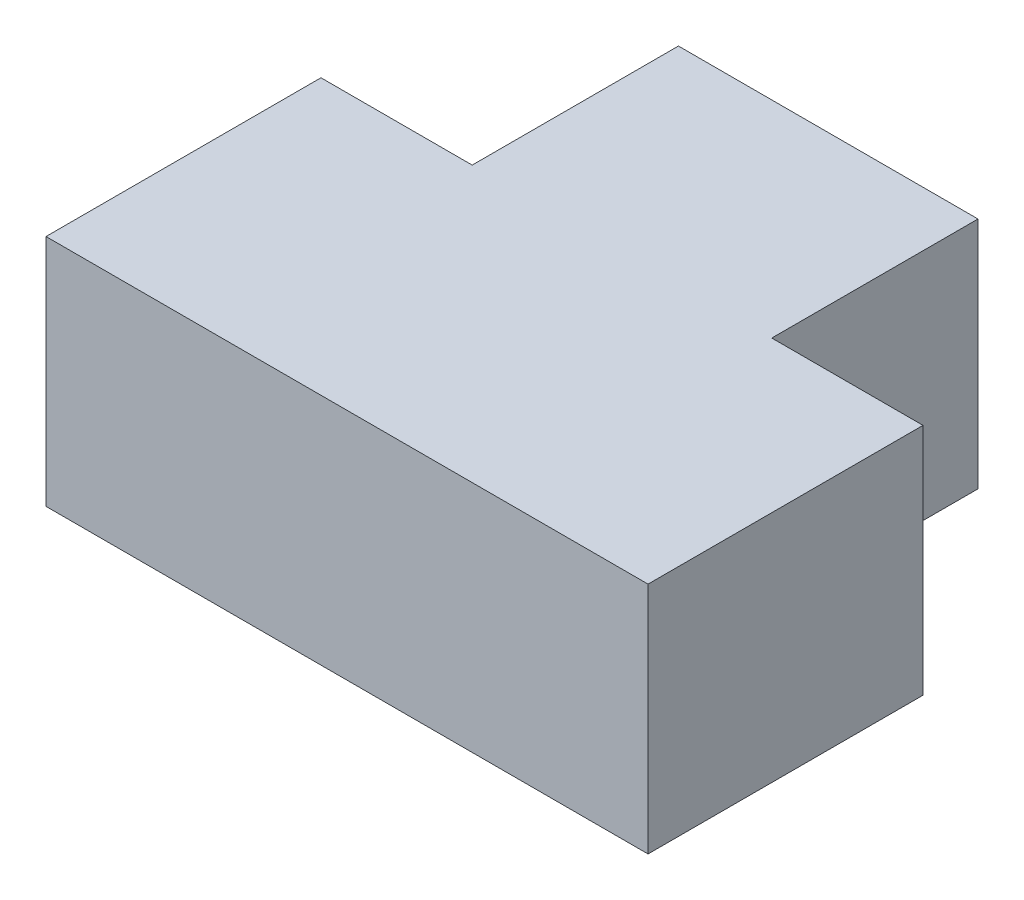
from build123d import *

# Parameters (mm, degrees)
EXTRUDE_1_DEPTH     = 3.4
SKETCH_2_W          = 0.4
SKETCH_2_H          = 3
CUT_EXTRUDE_1_DEPTH = 7.83637537


with BuildPart() as part:
    # Эскиз1 → Бобышка-Вытянуть1 (new body)
    with BuildSketch(Plane(origin=(0, 0, 0), x_dir=(1, 0, 0), z_dir=(0, 1, 0))):
        Polygon((2.37904421, -4), (-2.37904421, -4), (-4.37904421, -4), (-4.37904421, 0), (-2.37904421, 0), (-2.37904421, 3), (2.37904421, 3), (2.37904421, 0), (4.37904421, 0), (4.37904421, -4), align=None)
    extrude(amount=EXTRUDE_1_DEPTH)

    # Эскиз2 → Вырез-Вытянуть1 (cut, through all)
    with BuildSketch(Plane(origin=(0, 0, 0), x_dir=(1, 0, 0), z_dir=(0, 1, 0))):
        with Locations((2.37904421, 1.5)):
            Rectangle(SKETCH_2_W, SKETCH_2_H)
        with Locations((-2.37904421, 1.5)):
            Rectangle(SKETCH_2_W, SKETCH_2_H)
    extrude(amount=CUT_EXTRUDE_1_DEPTH, mode=Mode.SUBTRACT)


solid = part.part
